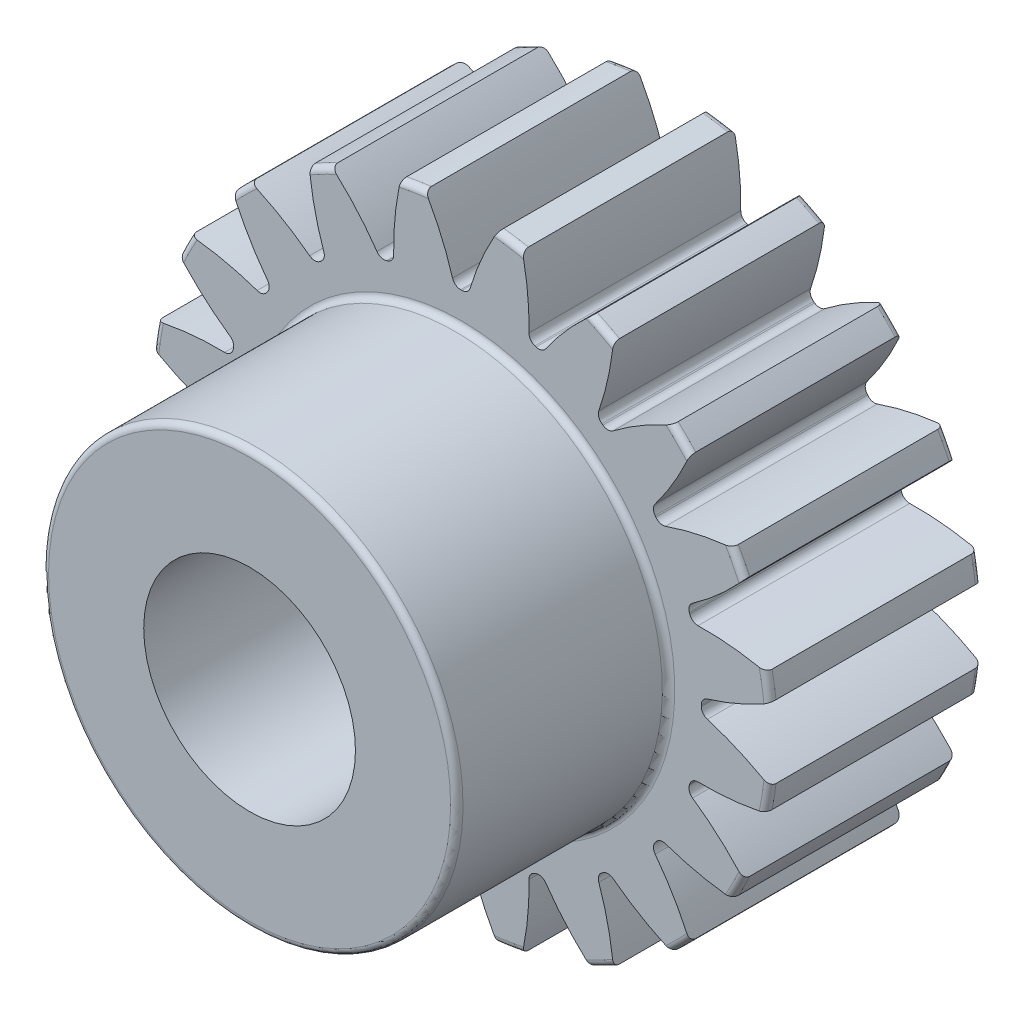
from build123d import *

# Parameters (mm, degrees)
FILLET2_R          = 0.2794
CUT_EXTRUDE2_DEPTH = 22.932793497
CIRPATTERN1_COUNT  = 20


with BuildPart() as part:
    # Sketch4 → Revolve1 (revolve)
    with BuildSketch(Plane(origin=(0, 0, 0), x_dir=(0, 0, -1), z_dir=(1, 0, 0))):
        Polygon((-19.05, 4.7625), (-19.05, 9.3218), (-9.525, 9.3218), (-9.525, 13.97), (0, 13.97), (0, 4.7625), align=None)
    revolve(axis=Axis((0, 0, 9.525), (0, 0, 1)))

    # Fillet2
    fillet2_edges = [part.edges().sort_by_distance(p)[0] for p in [
        (0, -13.97, 0),
        (0, -13.97, 9.525),
        (0, -9.3218, 9.525),
        (0, -9.3218, 19.05),
    ]]
    fillet(fillet2_edges, radius=FILLET2_R)

    # Sketch7 → Cut-Extrude2 (cut, through all)
    with BuildSketch(Plane.XY.offset(9.525)):
        with BuildLine():
            ThreePointArc((-0.029449487, 10.79495983), (0, 10.795), (0.029449487, 10.79495983))
            ThreePointArc((0.029449487, 10.79495983), (0.257238629, 10.869772623), (0.395246272, 11.06583062))
            ThreePointArc((0.395246272, 11.06583062), (0.92781573, 12.507614405), (1.630655191, 13.874504087))
            ThreePointArc((1.630655191, 13.874504087), (0, 13.97), (-1.630655191, 13.874504087))
            ThreePointArc((-1.630655191, 13.874504087), (-0.92781573, 12.507614405), (-0.395246272, 11.06583062))
            ThreePointArc((-0.395246272, 11.06583062), (-0.257238629, 10.869772623), (-0.029449487, 10.79495983))
        make_face()
    cut_extrude2 = extrude(amount=-CUT_EXTRUDE2_DEPTH, mode=Mode.SUBTRACT)

    # CirPattern1: Cut-Extrude2 ×20 about axis
    cirpattern1_axis = Axis((0, 0, 0), (0, 0, 1))
    for i in range(1, CIRPATTERN1_COUNT):
        add(cut_extrude2.rotate(cirpattern1_axis, i * 360 / CIRPATTERN1_COUNT), mode=Mode.SUBTRACT)


solid = part.part
